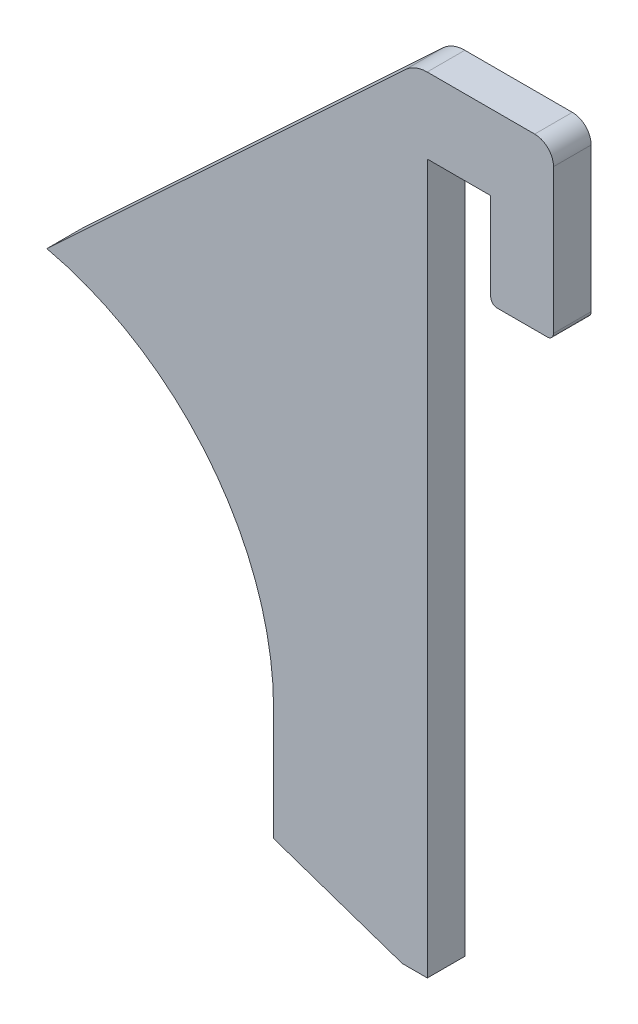
from build123d import *
from OCP.BRepFilletAPI import BRepFilletAPI_MakeFillet

# Parameters (mm, degrees)
BOSS_EXTRU_1_DEPTH = 6
FILLET1_R1         = 5
FILLET1_R2         = 3
FILLET1_R3         = 1


with BuildPart() as part:
    # Esquisse1 → Boss.-Extru.1 (new body)
    with BuildSketch(Plane.XY):
        with BuildLine():
            Line((46.5, 0), (46.5, -18))
            Line((46.5, -18), (67, -25))
            Line((67, -25), (71, -25))
            Line((71, -25), (71, 88))
            Line((71, 88), (81.1, 88))
            Line((81.1, 88), (81.1, 73))
            Line((81.1, 73), (91.1, 73))
            Line((91.1, 73), (91.1, 100))
            Line((91.1, 100), (69, 100))
            Line((69, 100), (10.371982926, 45.328489608))
            ThreePointArc((10.371982926, 45.328489608), (36.363080219, 28.982346298), (46.5, 0))
        make_face()
    extrude(amount=BOSS_EXTRU_1_DEPTH)

    # Fillet1: one fillet with a radius per group of edges: ONE call of the kernel's fillet builder (fillet() takes one radius for all edges)
    fillet1_edges_1 = [part.edges().sort_by_distance(p)[0] for p in [
        (69, 100, 3),
    ]]
    fillet1_edges_2 = [part.edges().sort_by_distance(p)[0] for p in [
        (91.1, 100, 3),
    ]]
    fillet1_edges_3 = [part.edges().sort_by_distance(p)[0] for p in [
        (91.1, 73, 3),
        (81.1, 73, 3),
    ]]
    fillet1 = BRepFilletAPI_MakeFillet(part.part.solid().wrapped)
    for e in fillet1_edges_1:
        fillet1.Add(FILLET1_R1, e.wrapped)
    for e in fillet1_edges_2:
        fillet1.Add(FILLET1_R2, e.wrapped)
    for e in fillet1_edges_3:
        fillet1.Add(FILLET1_R3, e.wrapped)
    add(Compound.cast(fillet1.Shape()), mode=Mode.REPLACE)


solid = part.part
